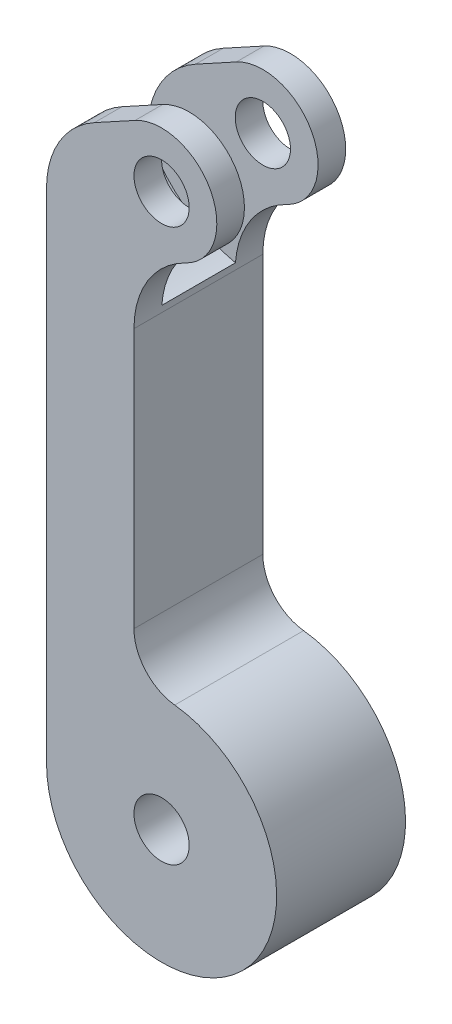
from build123d import *

# Parameters (mm, degrees)
CROQUIS1_R              = 3
SALIENTE_EXTRUIR1_DEPTH = 14
REDONDEO1_R             = 10
REDONDEO2_R             = 10
REDONDEO3_R             = 5
CORTAR_EXTRUIR1_START   = -3
CROQUIS2_R              = 14
CORTAR_EXTRUIR1_DEPTH   = 8


with BuildPart() as part:
    # Croquis1 → Saliente-Extruir1 (new body)
    with BuildSketch(Plane.XY):
        with BuildLine():
            ThreePointArc((-12.5, 0), (9.842509843, -7.705517504), (-3, 12.1346611))
            Line((-3, 12.1346611), (-3, 54.803847577))
            ThreePointArc((-3, 54.803847577), (5.999605182, 59.93116932), (-2.88, 65.263610928))
            Line((-2.88, 65.263610928), (-12.5, 60))
            Line((-12.5, 60), (-12.5, 0))
        make_face()
        Circle(CROQUIS1_R, mode=Mode.SUBTRACT)
        with Locations((0, 60)):
            Circle(CROQUIS1_R, mode=Mode.SUBTRACT)
    extrude(amount=SALIENTE_EXTRUIR1_DEPTH)

    # Redondeo1
    redondeo1_edges = [part.edges().sort_by_distance(p)[0] for p in [
        (-12.5, 60, 7),
    ]]
    fillet(redondeo1_edges, radius=REDONDEO1_R)

    # Redondeo2
    redondeo2_edges = [part.edges().sort_by_distance(p)[0] for p in [
        (-3, 54.803847577, 7),
    ]]
    fillet(redondeo2_edges, radius=REDONDEO2_R)

    # Redondeo3
    redondeo3_edges = [part.edges().sort_by_distance(p)[0] for p in [
        (-3, 12.1346611, 7),
    ]]
    fillet(redondeo3_edges, radius=REDONDEO3_R)

    # Croquis2 → Cortar-Extruir1 (cut)
    with BuildSketch(Plane.XY.offset(14).offset(CORTAR_EXTRUIR1_START)):
        with Locations((0, 60)):
            Circle(CROQUIS2_R)
    extrude(amount=-CORTAR_EXTRUIR1_DEPTH, mode=Mode.SUBTRACT)


solid = part.part
